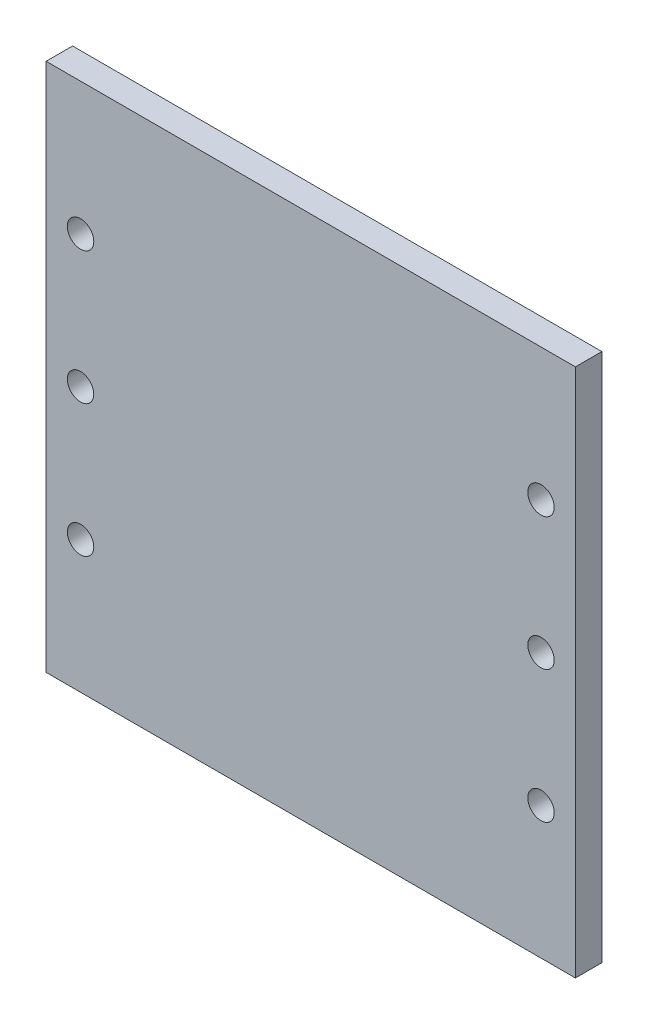
from build123d import *

# Parameters (mm, degrees)
SKETCH1_W           = 100
SKETCH1_H           = 100
SKETCH1_R           = 2.5
BOSS_EXTRUDE1_DEPTH = 5


with BuildPart() as part:
    # Sketch1 → Boss-Extrude1 (new body)
    with BuildSketch(Plane.XY):
        with Locations((50, 50)):
            Rectangle(SKETCH1_W, SKETCH1_H)
        with Locations((6.5, 75)):
            Circle(SKETCH1_R, mode=Mode.SUBTRACT)
        with Locations((6.5, 50)):
            Circle(SKETCH1_R, mode=Mode.SUBTRACT)
        with Locations((6.5, 25)):
            Circle(SKETCH1_R, mode=Mode.SUBTRACT)
        with Locations((93.5, 25)):
            Circle(SKETCH1_R, mode=Mode.SUBTRACT)
        with Locations((93.5, 50)):
            Circle(SKETCH1_R, mode=Mode.SUBTRACT)
        with Locations((93.5, 75)):
            Circle(SKETCH1_R, mode=Mode.SUBTRACT)
    extrude(amount=BOSS_EXTRUDE1_DEPTH)


solid = part.part
